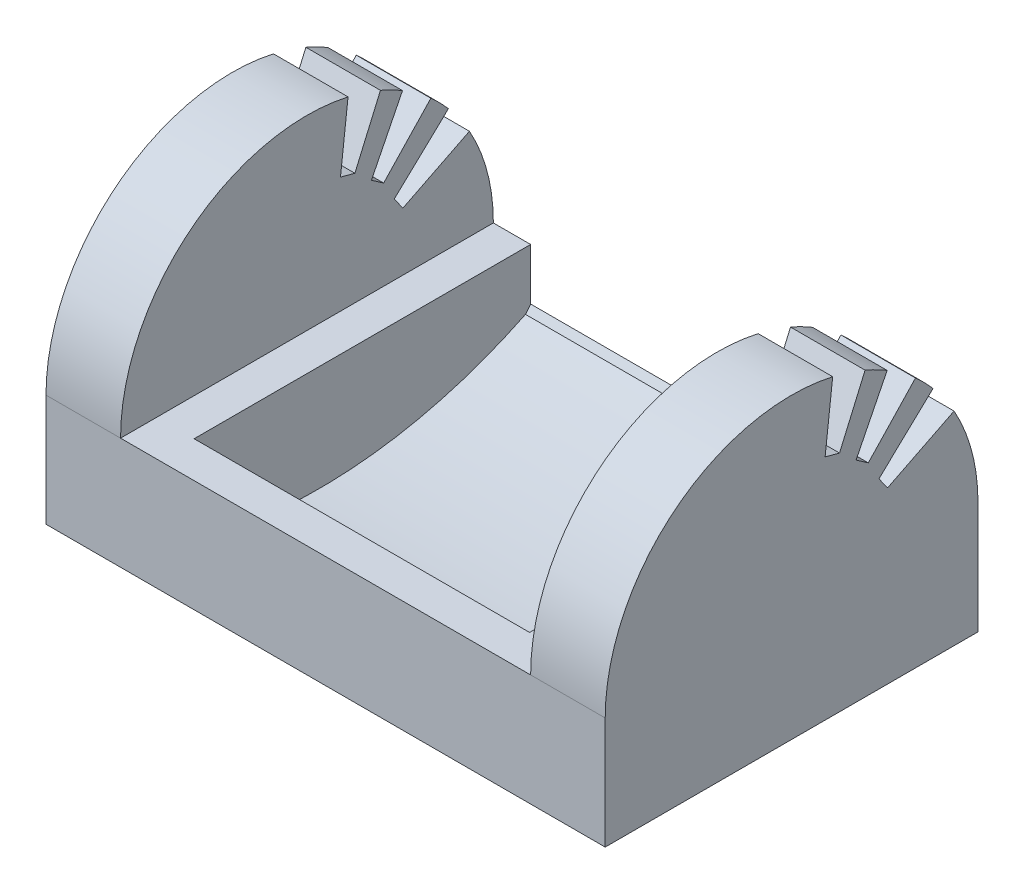
from build123d import *

# Parameters (mm, degrees)
SKETCH1_W           = 150
SKETCH1_H           = 100
BOSS_EXTRUDE1_DEPTH = 30
SKETCH3_W           = 20
SKETCH3_H           = 50
REVOLVE1_ANGLE      = 180
CUT_EXTRUDE2_DEPTH  = 198.230829233
CIRPATTERN1_COUNT   = 3
CIRPATTERN1_ANGLE   = 40
CUT_EXTRUDE3_START  = -30
CUT_EXTRUDE3_DEPTH  = 90


with BuildPart() as part:
    # Sketch1 → Boss-Extrude1 (new body)
    with BuildSketch(Plane(origin=(0, 0, 0), x_dir=(1, 0, 0), z_dir=(0, 1, 0))):
        with Locations((75, 50)):
            Rectangle(SKETCH1_W, SKETCH1_H)
    extrude(amount=BOSS_EXTRUDE1_DEPTH)

    # Sketch3 → Revolve1 (revolve)
    with BuildSketch(Plane(origin=(0, 30, 0), x_dir=(1, 0, 0), z_dir=(0, 1, 0))):
        with Locations((140, 75)):
            Rectangle(SKETCH3_W, SKETCH3_H)
        with Locations((10, 75)):
            Rectangle(SKETCH3_W, SKETCH3_H)
    revolve(axis=Axis((150, 30, -50), (1, 0, 0)), revolution_arc=REVOLVE1_ANGLE)

    # Sketch4 → Cut-Extrude2 (cut, through all)
    with BuildSketch(Plane(origin=(150, 0, 0), x_dir=(0, 0, -1), z_dir=(1, 0, 0))):
        Polygon((94.056786042, 54.745020752), (88.321021678, 62.936541195), (73.429921107, 48.847356556), (75.724226853, 45.570748379), align=None)
    cut_extrude2 = extrude(amount=-CUT_EXTRUDE2_DEPTH, mode=Mode.SUBTRACT)

    # CirPattern1: Cut-Extrude2 ×3 about axis
    cirpattern1_axis = Axis((0, 35.163146629, -49.309446005), (1, 0, 0))
    for i in range(1, CIRPATTERN1_COUNT):
        add(cut_extrude2.rotate(cirpattern1_axis, i * CIRPATTERN1_ANGLE / (CIRPATTERN1_COUNT - 1)), mode=Mode.SUBTRACT)

    # Sketch8 → Cut-Extrude3 (cut)
    with BuildSketch(Plane(origin=(150, 0, 0), x_dir=(0, 0, -1), z_dir=(1, 0, 0)).offset(CUT_EXTRUDE3_START)):
        with BuildLine():
            Line((111.193302221, 30), (9.733387686, 30))
            Line((9.733387686, 30), (9.733387686, 6.163594969))
            ThreePointArc((9.733387686, 6.163594969), (54.932592736, 2.173437288), (98.615148428, 14.450400418))
            Line((98.615148428, 14.450400418), (111.193302221, 30))
        make_face()
    extrude(amount=-CUT_EXTRUDE3_DEPTH, mode=Mode.SUBTRACT)


solid = part.part
